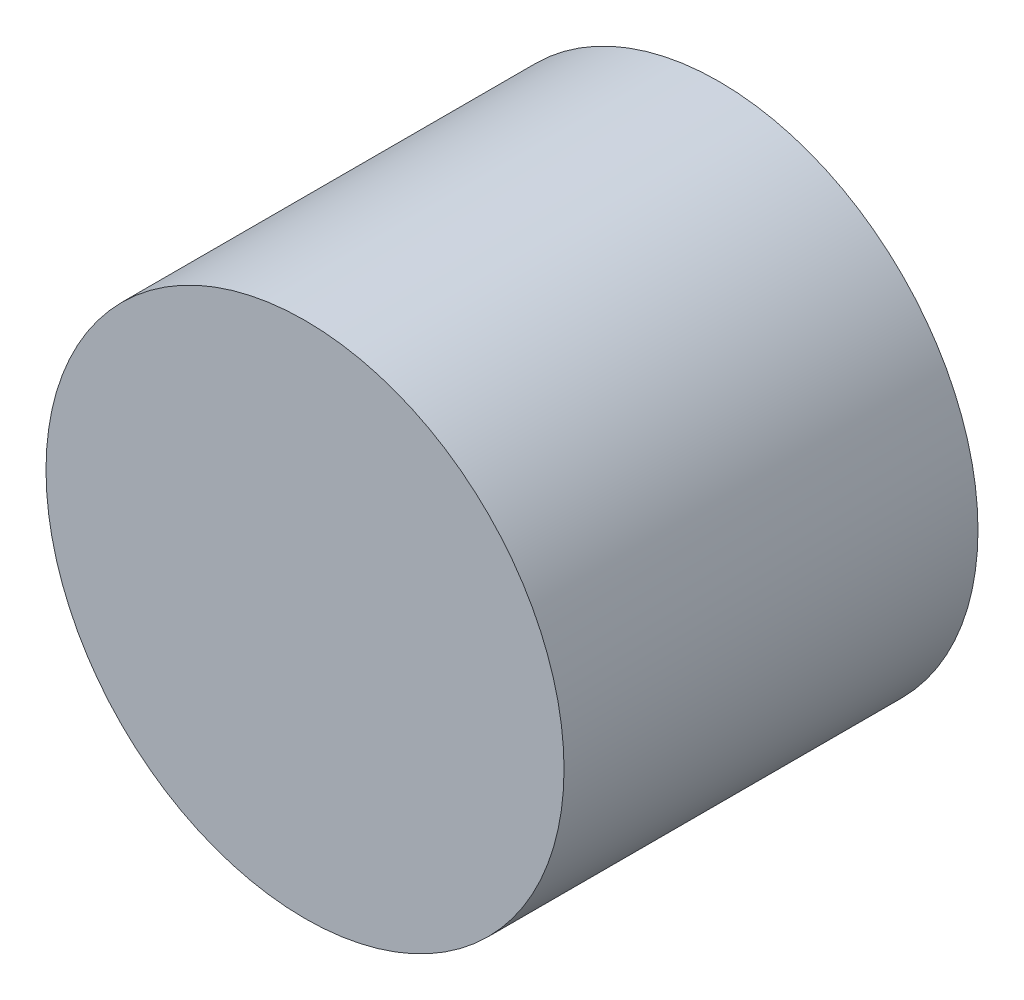
from build123d import *

# Parameters (mm, degrees)
SKETCH_2_R      = 62.569566228
EXTRUDE_2_DEPTH = 100


with BuildPart() as part:
    # 草图2 → 凸台-拉伸2 (new body)
    with BuildSketch(Plane.XY):
        Circle(SKETCH_2_R)
    extrude(amount=EXTRUDE_2_DEPTH)


solid = part.part
